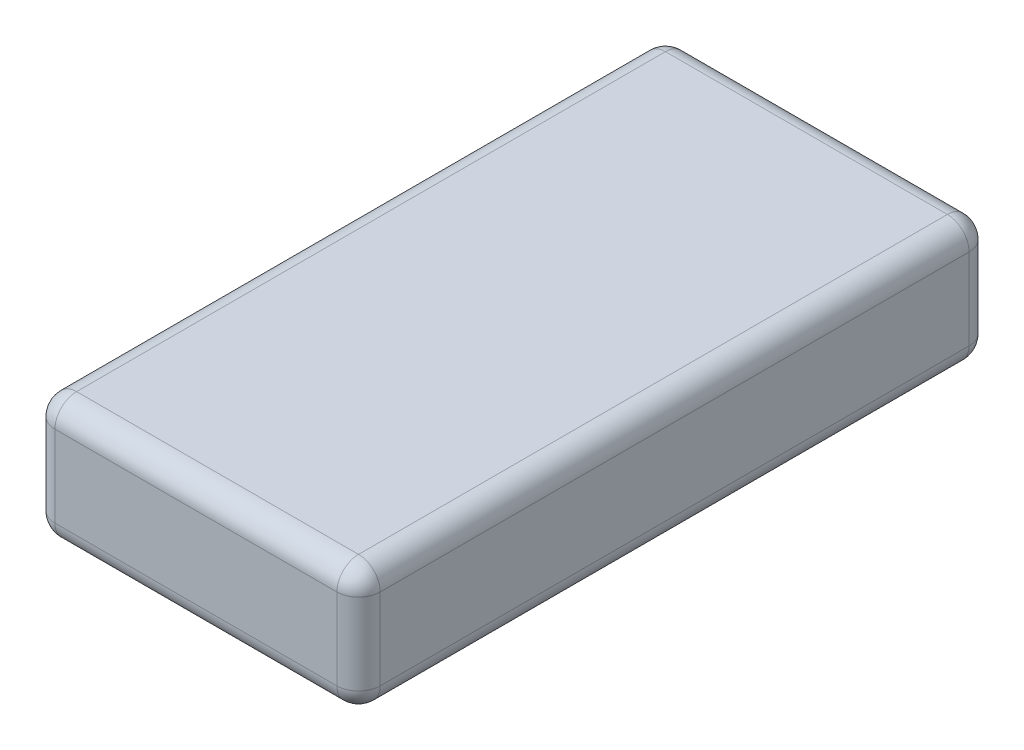
from build123d import *

# Parameters (mm, degrees)
SKETCH1_W           = 30
SKETCH1_H           = 58.3
BOSS_EXTRUDE1_DEPTH = 11.5
FILLET1_R           = 2


with BuildPart() as part:
    # Sketch1 → Boss-Extrude1 (new body)
    with BuildSketch(Plane(origin=(0, 0, 0), x_dir=(1, 0, 0), z_dir=(0, 1, 0))):
        Rectangle(SKETCH1_W, SKETCH1_H)
    extrude(amount=BOSS_EXTRUDE1_DEPTH)

    # Fillet1
    fillet1_edges = [part.edges().sort_by_distance(p)[0] for p in [
        (-15, 11.5, 0),
        (0, 11.5, 29.15),
        (15, 11.5, 0),
        (0, 0, 29.15),
        (-15, 0, 0),
        (0, 0, -29.15),
        (15, 0, 0),
        (15, 5.75, 29.15),
        (-15, 5.75, 29.15),
        (-15, 5.75, -29.15),
        (15, 5.75, -29.15),
        (0, 11.5, -29.15),
    ]]
    fillet(fillet1_edges, radius=FILLET1_R)


solid = part.part
